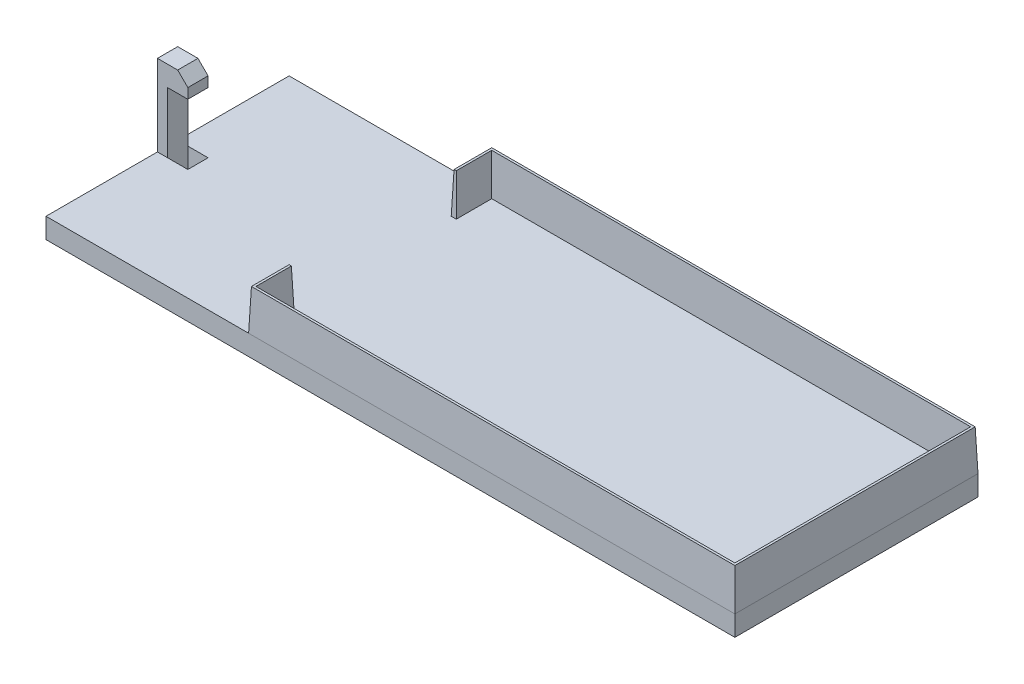
from build123d import *

# Parameters (mm, degrees)
SKETCH1_W           = 215.9
SKETCH1_H           = 76.2
BOSS_EXTRUDE1_DEPTH = 6.35
BOSS_EXTRUDE2_DEPTH = 12.7
BOSS_EXTRUDE2_TAPER = 2
BOSS_EXTRUDE3_DEPTH = 3.175
SKETCH4_W           = 6.35
SKETCH4_H           = 6.35
CUT_EXTRUDE1_DEPTH  = 118.26027686


with BuildPart() as part:
    # Sketch1 → Boss-Extrude1 (new body)
    with BuildSketch(Plane(origin=(0, 0, 0), x_dir=(1, 0, 0), z_dir=(0, 1, 0))):
        Rectangle(SKETCH1_W, SKETCH1_H)
    extrude(amount=BOSS_EXTRUDE1_DEPTH)

    # Sketch2 → Boss-Extrude2 (add)
    with BuildSketch(Plane(origin=(0, 6.35, 0), x_dir=(1, 0, 0), z_dir=(0, 1, 0))):
        Polygon((-44.45, -38.1), (107.95, -38.1), (107.95, 38.1), (-44.45, 38.1), (-44.45, 25.4), (-42.8625, 25.4), (-42.8625, 36.5125), (106.3625, 36.5125), (106.3625, -36.5125), (-42.8625, -36.5125), (-42.8625, -25.4), (-44.45, -25.4), align=None)
    extrude(amount=BOSS_EXTRUDE2_DEPTH, taper=BOSS_EXTRUDE2_TAPER)

    # Sketch3 → Boss-Extrude3 (add, symmetric)
    with BuildSketch(Plane.XY):
        Polygon((-107.95, 6.35), (-107.95, 31.75), (-101.6, 31.75), (-98.425, 28.575), (-98.425, 25.4), (-104.775, 25.4), (-104.775, 6.35), align=None)
    extrude(amount=BOSS_EXTRUDE3_DEPTH, both=True)

    # Sketch4 → Cut-Extrude1 (cut, through all)
    with BuildSketch(Plane(origin=(0, 6.35, 0), x_dir=(1, 0, 0), z_dir=(0, 1, 0))):
        with Locations((-101.6, 0)):
            Rectangle(SKETCH4_W, SKETCH4_H)
    extrude(amount=-CUT_EXTRUDE1_DEPTH, mode=Mode.SUBTRACT)


solid = part.part
